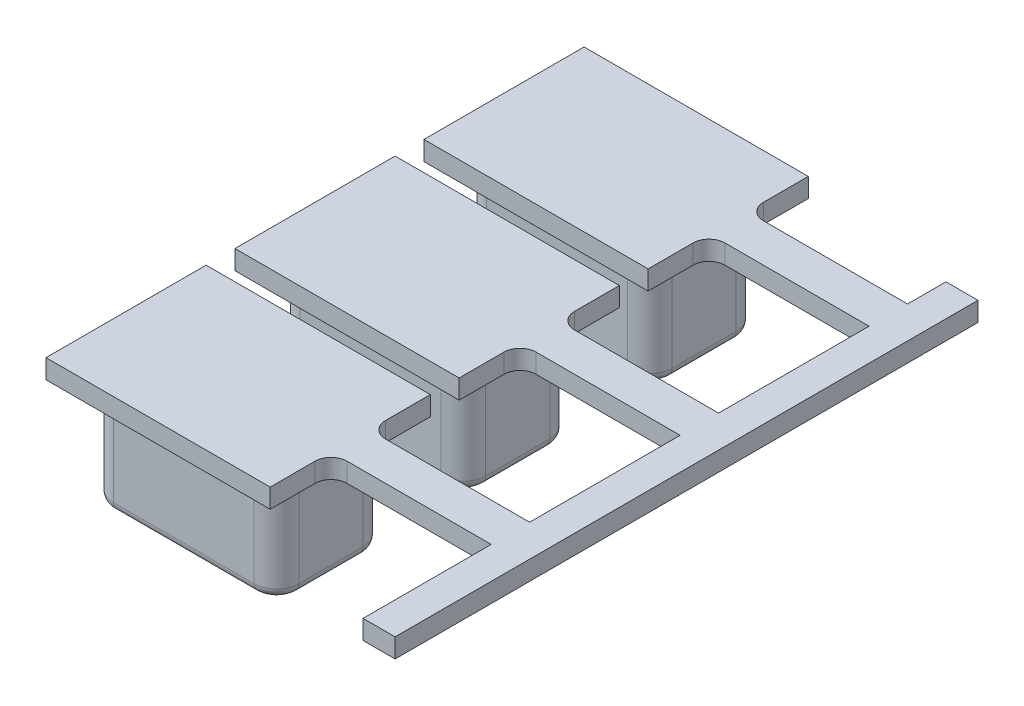
from build123d import *

# Parameters (mm, degrees)
EXTRUDE_1_DEPTH   = 4
EXTRUDE_1_2_DEPTH = 4
EXTRUDE_1_3_DEPTH = 4
SKETCH_2_W        = 7
SKETCH_2_H        = 5
EXTRUDE_2_DEPTH   = 0.6
SKETCH_3_W        = 6
SKETCH_3_H        = 1.2
EXTRUDE_3_DEPTH   = 0.6
SKETCH_4_W        = 1
SKETCH_4_H        = 13
EXTRUDE_4_DEPTH   = 0.6
FILLET_1_R        = 0.5
SKETCH_5_W        = 1
SKETCH_5_H        = 0.6
EXTRUDE_5_DEPTH   = 1.2
FILLET_2_R        = 0.3
SKETCH_7_W        = 1
SKETCH_7_H        = 0.6
EXTRUDE_6_DEPTH   = 4


with BuildPart() as part:
    # 草图1 → 凸台-拉伸1 (new body)
    with BuildSketch(Plane(origin=(0, 0, 0), x_dir=(1, 0, 0), z_dir=(0, 1, 0))):
        with BuildLine():
            Line((-2.2, 1.7), (2.2, 1.7))
            ThreePointArc((2.2, 1.7), (2.694974747, 1.494974747), (2.9, 1))
            Line((2.9, 1), (2.9, -1))
            ThreePointArc((2.9, -1), (2.694974747, -1.494974747), (2.2, -1.7))
            Line((2.2, -1.7), (-2.2, -1.7))
            ThreePointArc((-2.2, -1.7), (-2.694974747, -1.494974747), (-2.9, -1))
            Line((-2.9, -1), (-2.9, 1))
            ThreePointArc((-2.9, 1), (-2.694974747, 1.494974747), (-2.2, 1.7))
        make_face()
    extrude(amount=EXTRUDE_1_DEPTH)



with BuildPart() as body_2:
    # 草图1 → Extrude 1 2 (new body)
    with BuildSketch(Plane(origin=(0, 0, 0), x_dir=(1, 0, 0), z_dir=(0, 1, 0))):
        with BuildLine():
            Line((-2.2, 7.528722779), (2.2, 7.528722779))
            ThreePointArc((2.2, 7.528722779), (2.694974747, 7.323697526), (2.9, 6.828722779))
            Line((2.9, 6.828722779), (2.9, 4.828722779))
            ThreePointArc((2.9, 4.828722779), (2.694974747, 4.333748032), (2.2, 4.128722779))
            Line((2.2, 4.128722779), (-2.2, 4.128722779))
            ThreePointArc((-2.2, 4.128722779), (-2.694974747, 4.333748032), (-2.9, 4.828722779))
            Line((-2.9, 4.828722779), (-2.9, 6.828722779))
            ThreePointArc((-2.9, 6.828722779), (-2.694974747, 7.323697526), (-2.2, 7.528722779))
        make_face()
    extrude(amount=EXTRUDE_1_2_DEPTH)


with BuildPart() as body_3:
    # 草图1 → Extrude 1 3 (new body)
    with BuildSketch(Plane(origin=(0, 0, 0), x_dir=(1, 0, 0), z_dir=(0, 1, 0))):
        with BuildLine():
            Line((-2.2, 13.349128593), (2.2, 13.349128593))
            ThreePointArc((2.2, 13.349128593), (2.694974747, 13.144103339), (2.9, 12.649128593))
            Line((2.9, 12.649128593), (2.9, 10.649128593))
            ThreePointArc((2.9, 10.649128593), (2.694974747, 10.154153846), (2.2, 9.949128593))
            Line((2.2, 9.949128593), (-2.2, 9.949128593))
            ThreePointArc((-2.2, 9.949128593), (-2.694974747, 10.154153846), (-2.9, 10.649128593))
            Line((-2.9, 10.649128593), (-2.9, 12.649128593))
            ThreePointArc((-2.9, 12.649128593), (-2.694974747, 13.144103339), (-2.2, 13.349128593))
        make_face()
    extrude(amount=EXTRUDE_1_3_DEPTH)


with BuildPart() as part_1:
    add(part.part)

    add(body_2.part)  # 凸台-拉伸2 merges body 2

    add(body_3.part)  # 凸台-拉伸2 merges body 3
    # 草图2 → 凸台-拉伸2 (add)
    with BuildSketch(Plane(origin=(0, 4, 0), x_dir=(1, 0, 0), z_dir=(0, 1, 0))):
        with Locations((0.036699987, 11.763062551)):
            Rectangle(SKETCH_2_W, SKETCH_2_H)
        with Locations((0.036699987, 5.863062551)):
            Rectangle(SKETCH_2_W, SKETCH_2_H)
        with Locations((0.036699987, -0.036937449)):
            Rectangle(SKETCH_2_W, SKETCH_2_H)
    extrude(amount=-EXTRUDE_2_DEPTH)

    # 草图3 → 凸台-拉伸3 (add)
    with BuildSketch(Plane(origin=(0, 4, 0), x_dir=(1, 0, 0), z_dir=(0, 1, 0))):
        with Locations((6.536699987, 11.763062551)):
            Rectangle(SKETCH_3_W, SKETCH_3_H)
        with Locations((6.536699987, 5.863062551)):
            Rectangle(SKETCH_3_W, SKETCH_3_H)
        with Locations((6.536699987, -0.036937449)):
            Rectangle(SKETCH_3_W, SKETCH_3_H)
    extrude(amount=-EXTRUDE_3_DEPTH)

    # 草图4 → 凸台-拉伸4 (add)
    with BuildSketch(Plane.XZ.offset(-3.4)):
        with Locations((9.036699987, -5.863062551)):
            Rectangle(SKETCH_4_W, SKETCH_4_H)
    extrude(amount=-EXTRUDE_4_DEPTH)

    # 圆角1
    fillet_1_edges = [part_1.edges().sort_by_distance(p)[0] for p in [
        (3.536699987, 3.7, -11.163062551),
        (3.536699987, 3.7, -12.363062551),
        (3.536699987, 3.7, 0.636937449),
        (3.536699987, 3.7, -0.563062551),
        (3.536699987, 3.7, -5.263062551),
        (3.536699987, 3.7, -6.463062551),
    ]]
    fillet(fillet_1_edges, radius=FILLET_1_R)

    # 草图5 → 凸台-拉伸5 (add)
    with BuildSketch(Plane(origin=(0, 0, -12.363062551), x_dir=(-1, 0, 0), z_dir=(0, 0, -1))):
        with Locations((-9.036699987, 3.7)):
            Rectangle(SKETCH_5_W, SKETCH_5_H)
    extrude(amount=EXTRUDE_5_DEPTH)

    # 圆角2
    fillet_2_edges = [part_1.edges().sort_by_distance(p)[0] for p in [
        (-2.9, 0, 0),
        (-2.694974747, 0, -1.494974747),
        (-2.694974747, 0, -13.144103339),
        (-2.9, 0, -11.649128593),
        (-2.694974747, 0, -10.154153846),
        (0, 0, -9.949128593),
        (2.694974747, 0, -10.154153846),
        (2.9, 0, -11.649128593),
        (2.694974747, 0, -13.144103339),
        (0, 0, -13.349128593),
        (0, 0, -1.7),
        (2.694974747, 0, -1.494974747),
        (2.9, 0, 0),
        (2.694974747, 0, 1.494974747),
        (-2.694974747, 0, -7.323697526),
        (-2.9, 0, -5.828722779),
        (-2.694974747, 0, -4.333748032),
        (0, 0, -4.128722779),
        (2.694974747, 0, -4.333748032),
        (2.9, 0, -5.828722779),
        (2.694974747, 0, -7.323697526),
        (0, 0, 1.7),
        (0, 0, -7.528722779),
        (-2.694974747, 0, 1.494974747),
    ]]
    fillet(fillet_2_edges, radius=FILLET_2_R)

    # 草图7 → 凸台-拉伸6 (add)
    with BuildSketch(Plane.XY.offset(0.636937449)):
        with Locations((9.036699987, 3.7)):
            Rectangle(SKETCH_7_W, SKETCH_7_H)
    extrude(amount=EXTRUDE_6_DEPTH)


solid = part_1.part
